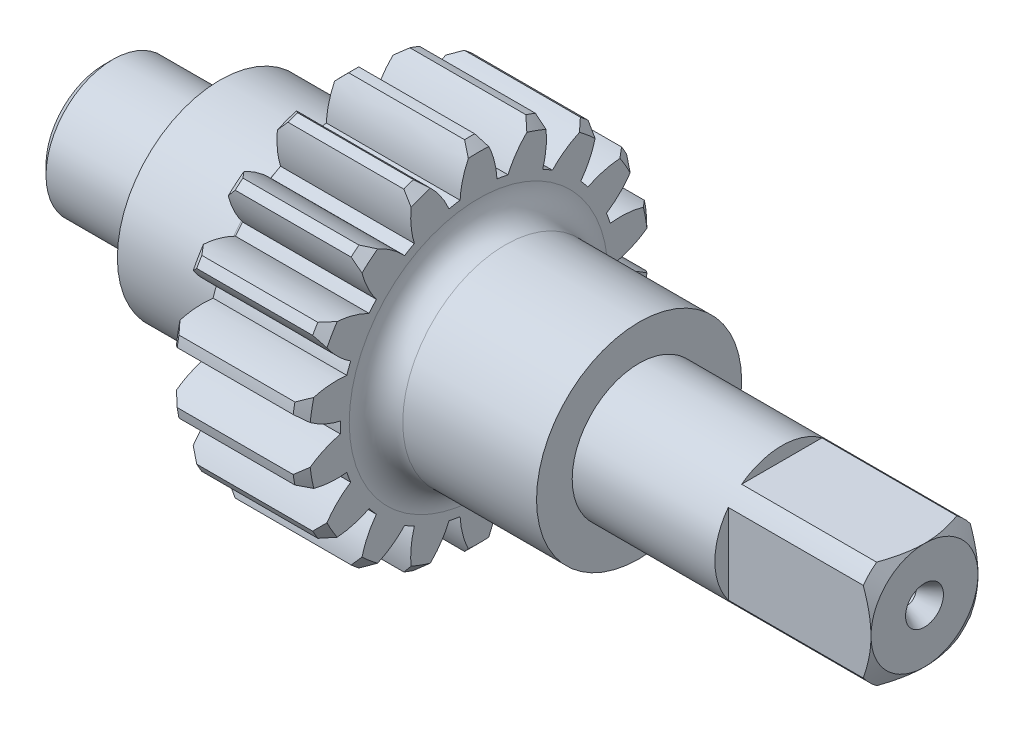
from build123d import *

# Parameters (mm, degrees)
BOSS_EXTRUDE1_START = -15
BOSS_EXTRUDE1_DEPTH = 15
CHAMFER1_SIZE       = 1
CHAMFER2_SIZE       = 1.5
CHAMFER2_SIZE2      = 0.866025404
CUT_EXTRUDE2_DEPTH  = 16
CHAMFER3_SIZE       = 1
CHAMFER4_SIZE       = 1
SCALE1_SCALE        = 1.19


with BuildPart() as part:
    # Sketch2 → Revolve1 (revolve)
    with BuildSketch(Plane.XY, mode=Mode.PRIVATE) as revolve1_sk:
        with BuildLine():
            Line((27, 15.5), (27, 14.5))
            ThreePointArc((27, 14.5), (26.121320344, 12.378679656), (24, 11.5))
            Line((24, 11.5), (13, 11.5))
            Line((13, 11.5), (13, 7.5))
            Line((13, 7.5), (0, 7.5))
            Line((0, 7.5), (0, 0))
            Line((0, 0), (92, 0))
            Line((92, 0), (92, 7.5))
            Line((92, 7.5), (60, 7.5))
            Line((60, 7.5), (60, 11.5))
            Line((60, 11.5), (45, 11.5))
            ThreePointArc((45, 11.5), (42.878679656, 12.378679656), (42, 14.5))
            Line((42, 14.5), (42, 15.5))
            Line((42, 15.5), (27, 15.5))
        make_face()
    revolve(revolve1_sk.sketch.rotate(Axis((0, 0, 0), (1, 0, 0)), 90), axis=Axis((0, 0, 0), (1, 0, 0)))

    # Sketch3 → Boss-Extrude1 (add)
    with BuildSketch(Plane(origin=(42, 0, 0), x_dir=(0, 0, -1), z_dir=(1, 0, 0)).offset(BOSS_EXTRUDE1_START)):
        with BuildLine():
            ThreePointArc((0.57, 19.99187585), (0, 20), (-0.57, 19.99187585))
            add(Edge.make_bspline(
                [(-0.57, 19.99187585), (-1.922955877, 17.877659072), (-2.07, 15.361155555)],
                knots=[0, 0, 0, 1, 1, 1], degree=2))
            ThreePointArc((-2.07, 15.361155555), (0, 15.5), (2.07, 15.361155555))
            add(Edge.make_bspline(
                [(0.57, 19.99187585), (1.922955877, 17.877659072), (2.07, 15.361155555)],
                knots=[0, 0, 0, 1, 1, 1], degree=2))
        make_face()
        with BuildLine():
            ThreePointArc((7.19898835, 13.726782826), (5.301312222, 14.565235622), (3.3086609, 15.142746219))
            add(Edge.make_bspline(
                [(6.30199945, 18.981169694), (4.307532071, 17.457193951), (3.3086609, 15.142746219)],
                knots=[0, 0, 0, 1, 1, 1], degree=2))
            ThreePointArc((6.30199945, 18.981169694), (6.840402867, 18.793852416), (7.373249037, 18.59126673))
            add(Edge.make_bspline(
                [(7.373249037, 18.59126673), (7.921506965, 16.141814662), (7.19898835, 13.726782826)],
                knots=[0, 0, 0, 1, 1, 1], degree=2))
        make_face()
        with BuildLine():
            ThreePointArc((11.459672459, 10.436757501), (9.96320795, 11.873688868), (8.288248464, 13.097898205))
            add(Edge.make_bspline(
                [(12.413884758, 15.68105434), (10.018468078, 14.931133599), (8.288248464, 13.097898205)],
                knots=[0, 0, 0, 1, 1, 1], degree=2))
            ThreePointArc((12.413884758, 15.68105434), (12.855752194, 15.320888862), (13.287175423, 14.948276465))
            add(Edge.make_bspline(
                [(13.287175423, 14.948276465), (12.964607405, 12.459029177), (11.459672459, 10.436757501)],
                knots=[0, 0, 0, 1, 1, 1], degree=2))
        make_face()
        with BuildLine():
            ThreePointArc((14.338150943, 5.887905192), (13.423393759, 7.75), (12.268150943, 9.473250364))
            add(Edge.make_bspline(
                [(17.028472355, 10.489572405), (14.521028978, 10.604158175), (12.268150943, 9.473250364)],
                knots=[0, 0, 0, 1, 1, 1], degree=2))
            ThreePointArc((17.028472355, 10.489572405), (17.320508076, 10), (17.598472355, 9.502303445))
            add(Edge.make_bspline(
                [(17.598472355, 9.502303445), (16.443984855, 7.273500897), (14.338150943, 5.887905192)],
                knots=[0, 0, 0, 1, 1, 1], degree=2))
        make_face()
        with BuildLine():
            ThreePointArc((15.487236814, 0.62888462), (15.264520172, 2.691546754), (14.768333359, 4.705988718))
            add(Edge.make_bspline(
                [(19.589174873, 4.032893229), (17.272139476, 4.998164775), (14.768333359, 4.705988718)],
                knots=[0, 0, 0, 1, 1, 1], degree=2))
            ThreePointArc((19.589174873, 4.032893229), (19.69615506, 3.472963553), (19.787133796, 2.91021239))
            add(Edge.make_bspline(
                [(19.787133796, 2.91021239), (17.939975043, 1.210681063), (15.487236814, 0.62888462)],
                knots=[0, 0, 0, 1, 1, 1], degree=2))
        make_face()
        with BuildLine():
            ThreePointArc((14.768333359, -4.705988718), (15.264520172, -2.691546754), (15.487236814, -0.62888462))
            add(Edge.make_bspline(
                [(19.787133796, -2.91021239), (17.939975043, -1.210681063), (15.487236814, -0.62888462)],
                knots=[0, 0, 0, 1, 1, 1], degree=2))
            ThreePointArc((19.787133796, -2.91021239), (19.69615506, -3.472963553), (19.589174873, -4.032893229))
            add(Edge.make_bspline(
                [(19.589174873, -4.032893229), (17.272139476, -4.998164775), (14.768333359, -4.705988718)],
                knots=[0, 0, 0, 1, 1, 1], degree=2))
        make_face()
        with BuildLine():
            ThreePointArc((12.268150943, -9.473250364), (13.423393759, -7.75), (14.338150943, -5.887905192))
            add(Edge.make_bspline(
                [(17.598472355, -9.502303445), (16.443984855, -7.273500897), (14.338150943, -5.887905192)],
                knots=[0, 0, 0, 1, 1, 1], degree=2))
            ThreePointArc((17.598472355, -9.502303445), (17.320508076, -10), (17.028472355, -10.489572405))
            add(Edge.make_bspline(
                [(17.028472355, -10.489572405), (14.521028978, -10.604158175), (12.268150943, -9.473250364)],
                knots=[0, 0, 0, 1, 1, 1], degree=2))
        make_face()
        with BuildLine():
            ThreePointArc((8.288248464, -13.097898205), (9.96320795, -11.873688868), (11.459672459, -10.436757501))
            add(Edge.make_bspline(
                [(13.287175423, -14.948276465), (12.964607405, -12.459029177), (11.459672459, -10.436757501)],
                knots=[0, 0, 0, 1, 1, 1], degree=2))
            ThreePointArc((13.287175423, -14.948276465), (12.855752194, -15.320888862), (12.413884758, -15.68105434))
            add(Edge.make_bspline(
                [(12.413884758, -15.68105434), (10.018468078, -14.931133599), (8.288248464, -13.097898205)],
                knots=[0, 0, 0, 1, 1, 1], degree=2))
        make_face()
        with BuildLine():
            ThreePointArc((3.3086609, -15.142746219), (5.301312222, -14.565235622), (7.19898835, -13.726782826))
            add(Edge.make_bspline(
                [(7.373249037, -18.59126673), (7.921506965, -16.141814662), (7.19898835, -13.726782826)],
                knots=[0, 0, 0, 1, 1, 1], degree=2))
            ThreePointArc((7.373249037, -18.59126673), (6.840402867, -18.793852416), (6.30199945, -18.981169694))
            add(Edge.make_bspline(
                [(6.30199945, -18.981169694), (4.307532071, -17.457193951), (3.3086609, -15.142746219)],
                knots=[0, 0, 0, 1, 1, 1], degree=2))
        make_face()
        with BuildLine():
            ThreePointArc((-2.07, -15.361155555), (0, -15.5), (2.07, -15.361155555))
            add(Edge.make_bspline(
                [(0.57, -19.99187585), (1.922955877, -17.877659072), (2.07, -15.361155555)],
                knots=[0, 0, 0, 1, 1, 1], degree=2))
            ThreePointArc((0.57, -19.99187585), (0, -20), (-0.57, -19.99187585))
            add(Edge.make_bspline(
                [(-0.57, -19.99187585), (-1.922955877, -17.877659072), (-2.07, -15.361155555)],
                knots=[0, 0, 0, 1, 1, 1], degree=2))
        make_face()
        with BuildLine():
            ThreePointArc((-7.19898835, -13.726782826), (-5.301312222, -14.565235622), (-3.3086609, -15.142746219))
            add(Edge.make_bspline(
                [(-6.30199945, -18.981169694), (-4.307532071, -17.457193951), (-3.3086609, -15.142746219)],
                knots=[0, 0, 0, 1, 1, 1], degree=2))
            ThreePointArc((-6.30199945, -18.981169694), (-6.840402867, -18.793852416), (-7.373249037, -18.59126673))
            add(Edge.make_bspline(
                [(-7.373249037, -18.59126673), (-7.921506965, -16.141814662), (-7.19898835, -13.726782826)],
                knots=[0, 0, 0, 1, 1, 1], degree=2))
        make_face()
        with BuildLine():
            ThreePointArc((-11.459672459, -10.436757501), (-9.96320795, -11.873688868), (-8.288248464, -13.097898205))
            add(Edge.make_bspline(
                [(-12.413884758, -15.68105434), (-10.018468078, -14.931133599), (-8.288248464, -13.097898205)],
                knots=[0, 0, 0, 1, 1, 1], degree=2))
            ThreePointArc((-12.413884758, -15.68105434), (-12.855752194, -15.320888862), (-13.287175423, -14.948276465))
            add(Edge.make_bspline(
                [(-13.287175423, -14.948276465), (-12.964607405, -12.459029177), (-11.459672459, -10.436757501)],
                knots=[0, 0, 0, 1, 1, 1], degree=2))
        make_face()
        with BuildLine():
            ThreePointArc((-14.338150943, -5.887905192), (-13.423393759, -7.75), (-12.268150943, -9.473250364))
            add(Edge.make_bspline(
                [(-17.028472355, -10.489572405), (-14.521028978, -10.604158175), (-12.268150943, -9.473250364)],
                knots=[0, 0, 0, 1, 1, 1], degree=2))
            ThreePointArc((-17.028472355, -10.489572405), (-17.320508076, -10), (-17.598472355, -9.502303445))
            add(Edge.make_bspline(
                [(-17.598472355, -9.502303445), (-16.443984855, -7.273500897), (-14.338150943, -5.887905192)],
                knots=[0, 0, 0, 1, 1, 1], degree=2))
        make_face()
        with BuildLine():
            ThreePointArc((-15.487236814, -0.62888462), (-15.264520172, -2.691546754), (-14.768333359, -4.705988718))
            add(Edge.make_bspline(
                [(-19.589174873, -4.032893229), (-17.272139476, -4.998164775), (-14.768333359, -4.705988718)],
                knots=[0, 0, 0, 1, 1, 1], degree=2))
            ThreePointArc((-19.589174873, -4.032893229), (-19.69615506, -3.472963553), (-19.787133796, -2.91021239))
            add(Edge.make_bspline(
                [(-19.787133796, -2.91021239), (-17.939975043, -1.210681063), (-15.487236814, -0.62888462)],
                knots=[0, 0, 0, 1, 1, 1], degree=2))
        make_face()
        with BuildLine():
            ThreePointArc((-14.768333359, 4.705988718), (-15.264520172, 2.691546754), (-15.487236814, 0.62888462))
            add(Edge.make_bspline(
                [(-19.787133796, 2.91021239), (-17.939975043, 1.210681063), (-15.487236814, 0.62888462)],
                knots=[0, 0, 0, 1, 1, 1], degree=2))
            ThreePointArc((-19.787133796, 2.91021239), (-19.69615506, 3.472963553), (-19.589174873, 4.032893229))
            add(Edge.make_bspline(
                [(-19.589174873, 4.032893229), (-17.272139476, 4.998164775), (-14.768333359, 4.705988718)],
                knots=[0, 0, 0, 1, 1, 1], degree=2))
        make_face()
        with BuildLine():
            ThreePointArc((-12.268150943, 9.473250364), (-13.423393759, 7.75), (-14.338150943, 5.887905192))
            add(Edge.make_bspline(
                [(-17.598472355, 9.502303445), (-16.443984855, 7.273500897), (-14.338150943, 5.887905192)],
                knots=[0, 0, 0, 1, 1, 1], degree=2))
            ThreePointArc((-17.598472355, 9.502303445), (-17.320508076, 10), (-17.028472355, 10.489572405))
            add(Edge.make_bspline(
                [(-17.028472355, 10.489572405), (-14.521028978, 10.604158175), (-12.268150943, 9.473250364)],
                knots=[0, 0, 0, 1, 1, 1], degree=2))
        make_face()
        with BuildLine():
            ThreePointArc((-8.288248464, 13.097898205), (-9.96320795, 11.873688868), (-11.459672459, 10.436757501))
            add(Edge.make_bspline(
                [(-13.287175423, 14.948276465), (-12.964607405, 12.459029177), (-11.459672459, 10.436757501)],
                knots=[0, 0, 0, 1, 1, 1], degree=2))
            ThreePointArc((-13.287175423, 14.948276465), (-12.855752194, 15.320888862), (-12.413884758, 15.68105434))
            add(Edge.make_bspline(
                [(-12.413884758, 15.68105434), (-10.018468078, 14.931133599), (-8.288248464, 13.097898205)],
                knots=[0, 0, 0, 1, 1, 1], degree=2))
        make_face()
        with BuildLine():
            ThreePointArc((-3.3086609, 15.142746219), (-5.301312222, 14.565235622), (-7.19898835, 13.726782826))
            add(Edge.make_bspline(
                [(-7.373249037, 18.59126673), (-7.921506965, 16.141814662), (-7.19898835, 13.726782826)],
                knots=[0, 0, 0, 1, 1, 1], degree=2))
            ThreePointArc((-7.373249037, 18.59126673), (-6.840402867, 18.793852416), (-6.30199945, 18.981169694))
            add(Edge.make_bspline(
                [(-6.30199945, 18.981169694), (-4.307532071, 17.457193951), (-3.3086609, 15.142746219)],
                knots=[0, 0, 0, 1, 1, 1], degree=2))
        make_face()
    extrude(amount=BOSS_EXTRUDE1_DEPTH)

    # Sketch4 → Cut-Revolve1 (revolve, cut)
    with BuildSketch(Plane(origin=(0, 0, 0), x_dir=(1, 0, 0), z_dir=(0, 1, 0))):
        Polygon((86.75, 0), (92, 0), (92, 2.125833025), (90.05, 1), (88.25, 1), align=None)
        Polygon((5.25, 0), (0, 0), (0, 2.125833025), (1.95, 1), (3.75, 1), align=None)
    revolve(axis=Axis((92, 0, 0), (-1, 0, 0)), mode=Mode.SUBTRACT)

    # Chamfer1
    chamfer1_edges = [part.edges().sort_by_distance(p)[0] for p in [
        (0, 0, -7.5),
    ]]
    chamfer(chamfer1_edges, length=CHAMFER1_SIZE)

    # Chamfer2
    chamfer2_edges = [part.edges().sort_by_distance(p)[0] for p in [
        (92, 0, -7.5),
    ]]
    chamfer2_side = [part.faces().sort_by_distance(p)[0] for p in [
        (92, 0, -7.287867966),
    ]]
    chamfer(chamfer2_edges, length=CHAMFER2_SIZE, length2=CHAMFER2_SIZE2, reference=chamfer2_side[0])

    # Sketch7 → Cut-Extrude2 (cut)
    with BuildSketch(Plane(origin=(92, 0, 0), x_dir=(0, 0, -1), z_dir=(1, 0, 0))):
        Polygon((0, 11), (6, 6), (-6, 6), align=None)
        Polygon((6, 6), (11, 0), (6, -6), align=None)
        Polygon((-6, -6), (-11, 0), (-6, 6), align=None)
        Polygon((6, -6), (0, -11), (-6, -6), align=None)
    extrude(amount=-CUT_EXTRUDE2_DEPTH, mode=Mode.SUBTRACT)

    # Chamfer3
    chamfer3_edges = [part.edges().sort_by_distance(p)[0] for p in [
        (42, -18.793852416, -6.840402867),
        (42, -15.320888862, -12.855752194),
        (42, -10, -17.320508076),
        (42, -3.472963553, -19.69615506),
        (42, 3.472963553, -19.69615506),
        (42, 10, -17.320508076),
        (42, 15.320888862, -12.855752194),
        (42, 18.793852416, -6.840402867),
        (42, 20, 0),
        (42, 18.793852416, 6.840402867),
        (42, 15.320888862, 12.855752194),
        (42, 10, 17.320508076),
        (42, 3.472963553, 19.69615506),
        (42, -3.472963553, 19.69615506),
        (42, -10, 17.320508076),
        (42, -20, 0),
        (42, -18.793852416, 6.840402867),
        (42, -15.320888862, 12.855752194),
    ]]
    chamfer(chamfer3_edges, length=CHAMFER3_SIZE)

    # Chamfer4
    chamfer4_edges = [part.edges().sort_by_distance(p)[0] for p in [
        (27, -18.793852416, -6.840402867),
        (27, -20, 0),
        (27, -18.793852416, 6.840402867),
        (27, -15.320888862, 12.855752194),
        (27, -10, 17.320508076),
        (27, -3.472963553, 19.69615506),
        (27, 3.472963553, 19.69615506),
        (27, 10, 17.320508076),
        (27, 15.320888862, 12.855752194),
        (27, 18.793852416, 6.840402867),
        (27, 20, 0),
        (27, 18.793852416, -6.840402867),
        (27, 15.320888862, -12.855752194),
        (27, 10, -17.320508076),
        (27, 3.472963553, -19.69615506),
        (27, -15.320888862, -12.855752194),
        (27, -3.472963553, -19.69615506),
        (27, -10, -17.320508076),
    ]]
    chamfer(chamfer4_edges, length=CHAMFER4_SIZE)


with BuildPart() as part_1:
    # Scale1: scaled about (39.510001725, 0, 0)
    add(part.part.scale(SCALE1_SCALE).moved(Location((-7.506900328, 0, 0))))


solid = part_1.part
